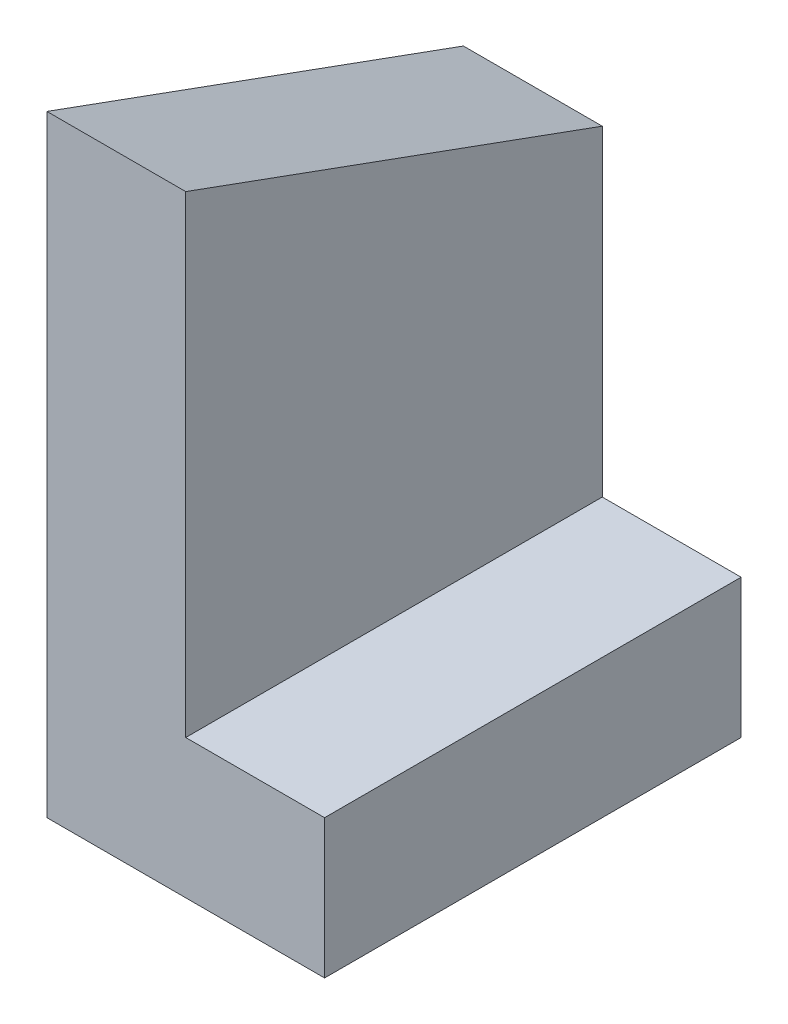
from build123d import *

# Parameters (mm, degrees)
BOSS_EXTRUDE1_DEPTH = 15
CUT_EXTRUDE1_DEPTH  = 10


with BuildPart() as part:
    # Sketch1 → Boss-Extrude1 (new body)
    with BuildSketch(Plane.XY):
        Polygon((0, 0), (0, 25), (5, 25), (5, 5), (10, 5), (10, 0), align=None)
    extrude(amount=BOSS_EXTRUDE1_DEPTH)

    # Sketch2 → Cut-Extrude1 (cut)
    with BuildSketch(Plane(origin=(5, 0, 0), x_dir=(0, 0, -1), z_dir=(1, 0, 0))):
        Polygon((-15, 22.026317018), (-18.328083999, 30.478992543), (8.324959991, 29.895957206), (0, 16.566763504), align=None)
    extrude(amount=-CUT_EXTRUDE1_DEPTH, mode=Mode.SUBTRACT)


solid = part.part
